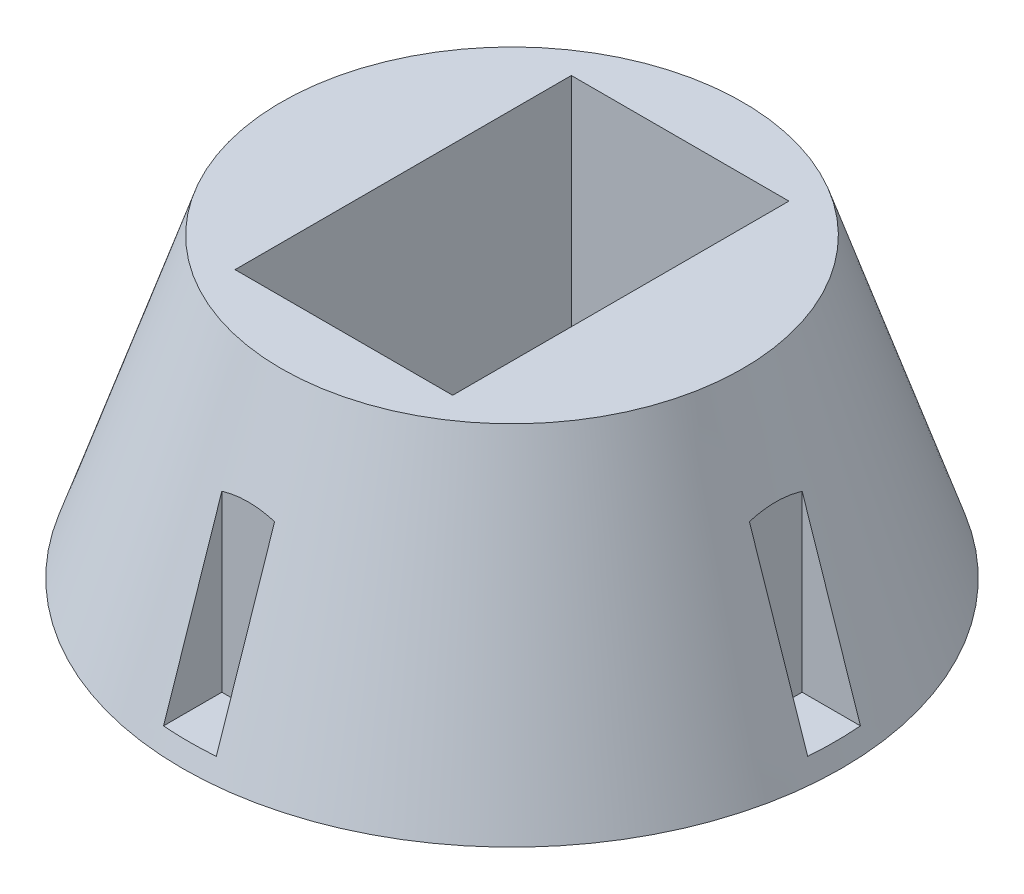
from build123d import *

# Parameters (mm, degrees)
ESQUISSE2_W             = 33
ESQUISSE2_H             = 51
ENL_V_MAT_EXTRU_1_DEPTH = 41
ESQUISSE3_W             = 8
ESQUISSE3_H             = 12
ESQUISSE3_W_2           = 12
ESQUISSE3_H_2           = 8
ENL_V_MAT_EXTRU_3_DEPTH = 42
ESQUISSE4_W             = 23.524420498
ESQUISSE4_H             = 14.572913479
ENL_V_MAT_EXTRU_4_DEPTH = 269
ESQUISSE6_R             = 2.08560847
ENL_V_MAT_EXTRU_5_DEPTH = 10


with BuildPart() as part:
    # Esquisse1 → Révolution1 (revolve)
    with BuildSketch(Plane.XY, mode=Mode.PRIVATE) as r_volution1_sk:
        Polygon((0, 0), (-50, 0), (-35, 45), (0, 45), align=None)
    revolve(r_volution1_sk.sketch.rotate(Axis((0, 185.624886126, 0), (0, -1, 0)), 270), axis=Axis((0, 185.624886126, 0), (0, -1, 0)))

    # Esquisse2 → Enlèv. mat.-Extru.1 (cut)
    with BuildSketch(Plane(origin=(0, 45, 0), x_dir=(1, 0, 0), z_dir=(0, 1, 0))):
        Rectangle(ESQUISSE2_W, ESQUISSE2_H)
    extrude(amount=-ENL_V_MAT_EXTRU_1_DEPTH, mode=Mode.SUBTRACT)

    # Esquisse3 → Enlèv. mat.-Extru.3 (cut)
    with BuildSketch(Plane(origin=(0, 45, 0), x_dir=(1, 0, 0), z_dir=(0, 1, 0))):
        with Locations((0, 46)):
            Rectangle(ESQUISSE3_W, ESQUISSE3_H)
        with Locations((46, 0)):
            Rectangle(ESQUISSE3_W_2, ESQUISSE3_H_2)
        with Locations((0, -46)):
            Rectangle(ESQUISSE3_W, ESQUISSE3_H)
        with Locations((-46, 0)):
            Rectangle(ESQUISSE3_W_2, ESQUISSE3_H_2)
    extrude(amount=-ENL_V_MAT_EXTRU_3_DEPTH, mode=Mode.SUBTRACT)

    # Esquisse4 → Enlèv. mat.-Extru.4 (cut)
    with BuildSketch(Plane(origin=(0, 4, 0), x_dir=(1, 0, 0), z_dir=(0, 1, 0))):
        with Locations((-1.026102351, -0.627863405)):
            Rectangle(ESQUISSE4_W, ESQUISSE4_H)
    extrude(amount=-ENL_V_MAT_EXTRU_4_DEPTH, mode=Mode.SUBTRACT)

    # Esquisse6 → Enlèv. mat.-Extru.5 (cut)
    with BuildSketch(Plane(origin=(0, 3, 0), x_dir=(1, 0, 0), z_dir=(0, 1, 0))):
        with Locations(Location((0, 44.460655409, 0), (0, 0, 270))):
            Circle(ESQUISSE6_R)
    extrude(amount=-ENL_V_MAT_EXTRU_5_DEPTH, mode=Mode.SUBTRACT)


solid = part.part
